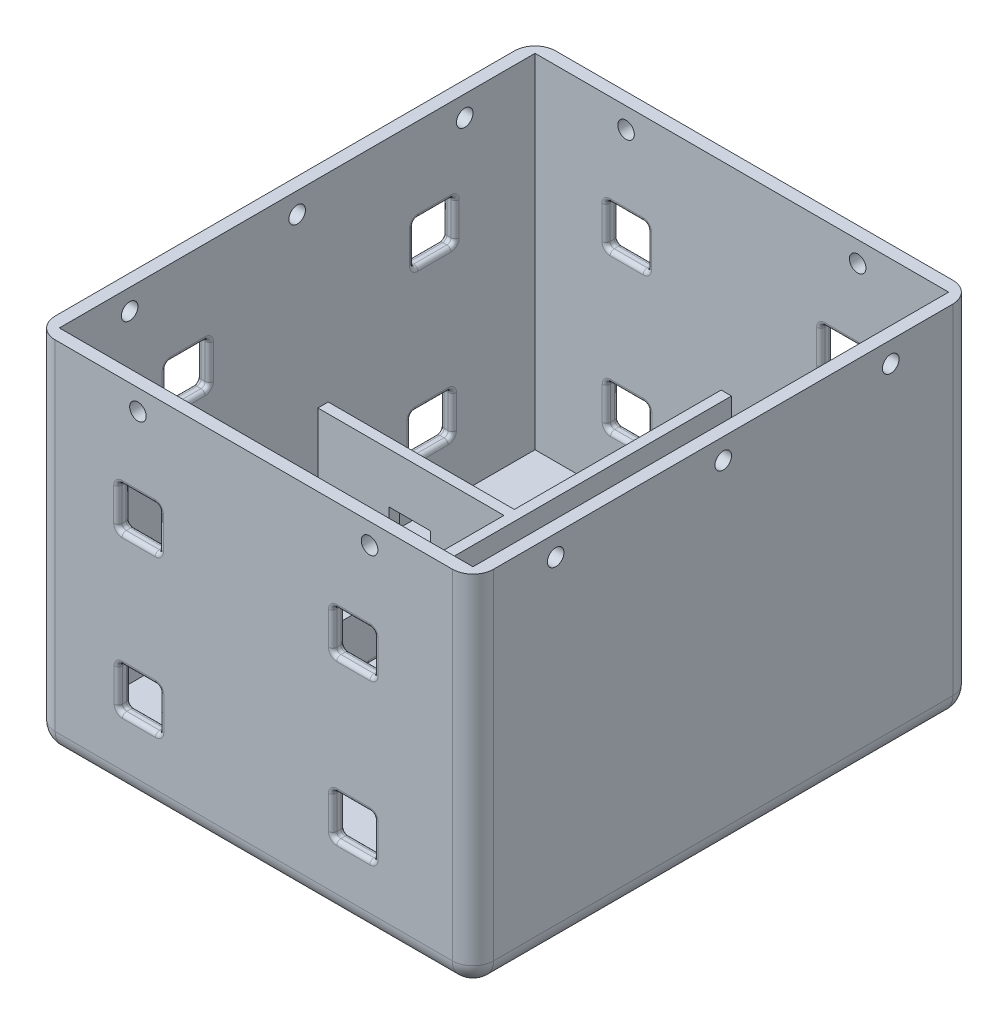
from build123d import *

# Parameters (mm, degrees)
SKETCH1_W                      = 106
SKETCH1_H                      = 121
SKETCH1_W_2                    = 100
SKETCH1_H_2                    = 115
BOSS_EXTRUDE1_DEPTH            = 83
SKETCH2_W                      = 106
SKETCH2_H                      = 121
BOSS_EXTRUDE2_DEPTH            = 4
BOSS_EXTRUDE3_DEPTH            = 35
CUT_EXTRUDE1_DEPTH             = 92
CUT_EXTRUDE1_DEPTH_BACK        = 75
SKETCH6_W                      = 10
SKETCH6_H                      = 10
CUT_EXTRUDE2_REACH             = 119.954
SKETCH7_W                      = 10
SKETCH7_H                      = 10
CUT_EXTRUDE2_DIRECTION_2_DEPTH = 8
SKETCH8_W                      = 10
SKETCH8_H                      = 10
CUT_EXTRUDE3_DEPTH             = 138
SKETCH9_W                      = 10
SKETCH9_H                      = 10
CUT_EXTRUDE4_DEPTH             = 138
SKETCH10_W                     = 10
SKETCH10_H                     = 10
SKETCH10_W_2                   = 10.370040033
SKETCH10_H_2                   = 10.370040033
CUT_EXTRUDE5_DEPTH             = 78
SKETCH11_R                     = 2
CUT_EXTRUDE6_DEPTH             = 132
SKETCH12_R                     = 2
CUT_EXTRUDE7_DEPTH             = 132
FILLET1_R                      = 5
FILLET2_R                      = 5
FILLET4_R                      = 1


with BuildPart() as part:
    # Sketch1 → Boss-Extrude1 (new body)
    with BuildSketch(Plane(origin=(0, 0, 0), x_dir=(1, 0, 0), z_dir=(0, 1, 0))):
        Rectangle(SKETCH1_W, SKETCH1_H)
        Rectangle(SKETCH1_W_2, SKETCH1_H_2, mode=Mode.SUBTRACT)
    extrude(amount=BOSS_EXTRUDE1_DEPTH)

    # Sketch2 → Boss-Extrude2 (add)
    with BuildSketch(Plane.XZ):
        Rectangle(SKETCH2_W, SKETCH2_H)
    extrude(amount=BOSS_EXTRUDE2_DEPTH)

    # Sketch3 → Boss-Extrude3 (add)
    with BuildSketch(Plane(origin=(0, 0, 0), x_dir=(1, 0, 0), z_dir=(0, 1, 0))):
        Polygon((-5, 57.5), (-5, 7.5), (-50, 7.5), (-50, 5), (-5, 5), (-5, -57.5), (-2.5, -57.5), (-2.5, 57.5), align=None)
    extrude(amount=BOSS_EXTRUDE3_DEPTH)

    # Sketch6 → Cut-Extrude1 (cut, two sides: drawn at the far end of the back side and taken through both)
    with BuildSketch(Plane.XY.offset(-5).offset(-CUT_EXTRUDE1_DEPTH_BACK)):
        with Locations((-27.748825873, 17.873316531)):
            Rectangle(SKETCH6_W, SKETCH6_H)
        with Locations((24.072315053, 17.126745646)):
            Rectangle(SKETCH6_W, SKETCH6_H)
    extrude(amount=CUT_EXTRUDE1_DEPTH + CUT_EXTRUDE1_DEPTH_BACK, mode=Mode.SUBTRACT)

    # Cut-Extrude2: up to this face of the body (flat: up to its plane)
    cut_extrude2_end = Plane(part.part.faces().sort_by_distance((-53, 39.5, 0))[0])
    # Sketch7 → Cut-Extrude2 (cut, up to the picked face)
    with BuildSketch(Plane.ZY.offset(5), mode=Mode.PRIVATE) as cut_extrude2_sk1:
        with Locations((26.25, 17.5)):
            Rectangle(SKETCH7_W, SKETCH7_H)
    cut_extrude2_tool1 = split(extrude(cut_extrude2_sk1.sketch, amount=CUT_EXTRUDE2_REACH, mode=Mode.PRIVATE), bisect_by=cut_extrude2_end, keep=Keep.BOTH, mode=Mode.PRIVATE)
    # Sketch7 → Cut-Extrude2 (cut, up to the picked face)
    with BuildSketch(Plane.ZY.offset(5), mode=Mode.PRIVATE) as cut_extrude2_sk2:
        with Locations((-32.5, 17.5)):
            Rectangle(SKETCH7_W, SKETCH7_H)
    cut_extrude2_tool2 = split(extrude(cut_extrude2_sk2.sketch, amount=CUT_EXTRUDE2_REACH, mode=Mode.PRIVATE), bisect_by=cut_extrude2_end, keep=Keep.BOTH, mode=Mode.PRIVATE)
    add(cut_extrude2_tool1.solids().sort_by(Axis((-5, 17.5, 26.25), (-1, 0, 0)))[0], mode=Mode.SUBTRACT)
    add(cut_extrude2_tool2.solids().sort_by(Axis((-5, 17.5, -32.5), (-1, 0, 0)))[0], mode=Mode.SUBTRACT)

    # Sketch7 → Cut-Extrude2 direction 2 (cut)
    with BuildSketch(Plane.ZY.offset(5)):
        with Locations((26.25, 17.5)):
            Rectangle(SKETCH7_W, SKETCH7_H)
        with Locations((-32.5, 17.5)):
            Rectangle(SKETCH7_W, SKETCH7_H)
    extrude(amount=-CUT_EXTRUDE2_DIRECTION_2_DEPTH, mode=Mode.SUBTRACT)

    # Sketch8 → Cut-Extrude3 (cut)
    with BuildSketch(Plane.XY.offset(60.5)):
        with Locations((-27.85, 55.67)):
            Rectangle(SKETCH8_W, SKETCH8_H)
    extrude(amount=-CUT_EXTRUDE3_DEPTH, mode=Mode.SUBTRACT)

    # Sketch9 → Cut-Extrude4 (cut)
    with BuildSketch(Plane.XY.offset(60.5)):
        with Locations((24.072315053, 55.67)):
            Rectangle(SKETCH9_W, SKETCH9_H)
    extrude(amount=-CUT_EXTRUDE4_DEPTH, mode=Mode.SUBTRACT)

    # Sketch10 → Cut-Extrude5 (cut)
    with BuildSketch(Plane.ZY.offset(53)):
        with Locations((-33.18, 57.54)):
            Rectangle(SKETCH10_W, SKETCH10_H)
        with Locations((26.435020017, 57.354979984)):
            Rectangle(SKETCH10_W_2, SKETCH10_H_2)
    extrude(amount=-CUT_EXTRUDE5_DEPTH, mode=Mode.SUBTRACT)

    # Sketch11 → Cut-Extrude6 (cut)
    with BuildSketch(Plane.ZY.offset(53)):
        with Locations((-40.5, 78)):
            Circle(SKETCH11_R)
        with Locations((0, 78)):
            Circle(SKETCH11_R)
        with Locations((40.5, 78)):
            Circle(SKETCH11_R)
    extrude(amount=-CUT_EXTRUDE6_DEPTH, mode=Mode.SUBTRACT)

    # Sketch12 → Cut-Extrude7 (cut)
    with BuildSketch(Plane(origin=(0, 0, -60.5), x_dir=(-1, 0, 0), z_dir=(0, 0, -1))):
        with Locations((-28, 78)):
            Circle(SKETCH12_R)
        with Locations((28, 78)):
            Circle(SKETCH12_R)
    extrude(amount=-CUT_EXTRUDE7_DEPTH, mode=Mode.SUBTRACT)

    # Fillet1
    fillet1_edges = [part.edges().sort_by_distance(p)[0] for p in [
        (53, 39.5, 60.5),
        (-53, 39.5, 60.5),
        (-53, 39.5, -60.5),
        (53, 39.5, -60.5),
    ]]
    fillet(fillet1_edges, radius=FILLET1_R)

    # Fillet2
    fillet2_edges = [part.edges().sort_by_distance(p)[0] for p in [
        (0, -4, -60.5),
        (-53, -4, 0),
        (53, -4, 0),
        (0, -4, 60.5),
        (-51.535533906, -4, -59.035533906),
        (-51.535533906, -4, 59.035533906),
        (51.535533906, -4, 59.035533906),
        (51.535533906, -4, -59.035533906),
    ]]
    fillet(fillet2_edges, radius=FILLET2_R)

    # Fillet4
    fillet4_edges = [part.edges().sort_by_distance(p)[0] for p in [
        (29.072315053, 17.126745646, -57.5),
        (29.072315053, 12.126745646, -59),
        (29.072315053, 12.126745646, 59),
        (29.072315053, 17.126745646, 57.5),
        (29.072315053, 17.126745646, -60.5),
        (24.072315053, 22.126745646, -57.5),
        (29.072315053, 22.126745646, -59),
        (29.072315053, 22.126745646, 59),
        (24.072315053, 22.126745646, 57.5),
        (24.072315053, 22.126745646, -60.5),
        (19.072315053, 17.126745646, -57.5),
        (19.072315053, 22.126745646, -59),
        (19.072315053, 22.126745646, 59),
        (19.072315053, 17.126745646, 57.5),
        (19.072315053, 17.126745646, -60.5),
        (24.072315053, 12.126745646, -57.5),
        (19.072315053, 12.126745646, -59),
        (19.072315053, 12.126745646, 59),
        (24.072315053, 12.126745646, 57.5),
        (24.072315053, 12.126745646, -60.5),
        (-2.5, 22.5, -32.5),
        (-2.5, 17.5, -37.5),
        (-2.5, 12.5, -32.5),
        (-2.5, 17.5, -27.5),
        (-2.5, 22.5, 26.25),
        (-2.5, 17.5, 21.25),
        (-2.5, 12.5, 26.25),
        (-2.5, 17.5, 31.25),
        (-50, 17.5, 31.25),
        (-3.75, 22.5, 31.25),
        (-5, 17.5, 31.25),
        (-51.5, 22.5, 31.25),
        (-53, 17.5, 31.25),
        (-50, 12.5, 26.25),
        (-3.75, 12.5, 31.25),
        (-5, 12.5, 26.25),
        (-51.5, 12.5, 31.25),
        (-53, 12.5, 26.25),
        (-50, 17.5, 21.25),
        (-3.75, 12.5, 21.25),
        (-5, 17.5, 21.25),
        (-51.5, 12.5, 21.25),
        (-53, 17.5, 21.25),
        (-50, 22.5, 26.25),
        (-3.75, 22.5, 21.25),
        (-5, 22.5, 26.25),
        (-51.5, 22.5, 21.25),
        (-53, 22.5, 26.25),
        (-50, 17.5, -27.5),
        (-3.75, 22.5, -27.5),
        (-5, 17.5, -27.5),
        (-51.5, 22.5, -27.5),
        (-53, 17.5, -27.5),
        (-50, 12.5, -32.5),
        (-3.75, 12.5, -27.5),
        (-5, 12.5, -32.5),
        (-51.5, 12.5, -27.5),
        (-53, 12.5, -32.5),
        (-50, 17.5, -37.5),
        (-3.75, 12.5, -37.5),
        (-5, 17.5, -37.5),
        (-51.5, 12.5, -37.5),
        (-53, 17.5, -37.5),
        (-50, 22.5, -32.5),
        (-3.75, 22.5, -37.5),
        (-5, 22.5, -32.5),
        (-51.5, 22.5, -37.5),
        (-53, 22.5, -32.5),
        (-32.85, 55.67, -57.5),
        (-32.85, 55.67, 57.5),
        (-32.85, 55.67, -60.5),
        (-32.85, 50.67, -59),
        (-32.85, 50.67, 59),
        (-27.85, 60.67, -57.5),
        (-27.85, 60.67, 57.5),
        (-27.85, 60.67, -60.5),
        (-32.85, 60.67, -59),
        (-32.85, 60.67, 59),
        (-22.85, 55.67, -57.5),
        (-22.85, 55.67, 57.5),
        (-22.85, 55.67, -60.5),
        (-22.85, 60.67, -59),
        (-22.85, 60.67, 59),
        (-27.85, 50.67, -57.5),
        (-27.85, 50.67, 57.5),
        (-27.85, 50.67, -60.5),
        (-22.85, 50.67, -59),
        (-22.85, 50.67, 59),
        (-32.85, 55.67, 60.5),
        (-27.85, 50.67, 60.5),
        (-22.85, 55.67, 60.5),
        (-27.85, 60.67, 60.5),
        (19.072315053, 55.67, -57.5),
        (19.072315053, 55.67, 57.5),
        (19.072315053, 55.67, -60.5),
        (19.072315053, 50.67, -59),
        (19.072315053, 50.67, 59),
        (24.072315053, 60.67, -57.5),
        (24.072315053, 60.67, 57.5),
        (24.072315053, 60.67, -60.5),
        (19.072315053, 60.67, -59),
        (19.072315053, 60.67, 59),
        (29.072315053, 55.67, -57.5),
        (29.072315053, 55.67, 57.5),
        (29.072315053, 55.67, -60.5),
        (29.072315053, 60.67, -59),
        (29.072315053, 60.67, 59),
        (24.072315053, 50.67, -57.5),
        (24.072315053, 50.67, 57.5),
        (24.072315053, 50.67, -60.5),
        (29.072315053, 50.67, -59),
        (29.072315053, 50.67, 59),
        (19.072315053, 55.67, 60.5),
        (24.072315053, 50.67, 60.5),
        (29.072315053, 55.67, 60.5),
        (24.072315053, 60.67, 60.5),
        (-50, 57.54, -28.18),
        (-50, 52.54, -33.18),
        (-50, 57.54, -38.18),
        (-50, 62.54, -33.18),
        (-51.5, 62.54, -28.18),
        (-51.5, 52.54, -28.18),
        (-51.5, 52.54, -38.18),
        (-51.5, 62.54, -38.18),
        (-53, 57.54, -28.18),
        (-53, 62.54, -33.18),
        (-53, 57.54, -38.18),
        (-53, 52.54, -33.18),
        (-50, 57.354979983, 21.25),
        (-50, 62.54, 26.435020017),
        (-50, 57.354979983, 31.620040033),
        (-50, 52.169959967, 26.435020017),
        (-51.5, 52.169959967, 21.25),
        (-51.5, 62.54, 21.25),
        (-51.5, 62.54, 31.620040033),
        (-51.5, 52.169959967, 31.620040033),
        (-53, 57.354979983, 21.25),
        (-53, 52.169959967, 26.435020017),
        (-53, 57.354979983, 31.620040033),
        (-53, 62.54, 26.435020017),
        (24.072315053, 12.126745646, 60.5),
        (19.072315053, 17.126745646, 60.5),
        (24.072315053, 22.126745646, 60.5),
        (29.072315053, 17.126745646, 60.5),
        (-22.748825873, 17.873316531, -57.5),
        (-22.748825873, 12.873316531, -59),
        (-22.748825873, 12.873316531, 59),
        (-22.748825873, 17.873316531, 57.5),
        (-22.748825873, 17.873316531, -60.5),
        (-27.748825873, 22.873316531, -57.5),
        (-22.748825873, 22.873316531, -59),
        (-22.748825873, 22.873316531, 59),
        (-27.748825873, 22.873316531, 57.5),
        (-27.748825873, 22.873316531, -60.5),
        (-32.748825873, 17.873316531, -57.5),
        (-32.748825873, 22.873316531, -59),
        (-32.748825873, 22.873316531, 59),
        (-32.748825873, 17.873316531, 57.5),
        (-32.748825873, 17.873316531, -60.5),
        (-27.748825873, 12.873316531, -57.5),
        (-32.748825873, 12.873316531, -59),
        (-32.748825873, 12.873316531, 59),
        (-27.748825873, 12.873316531, 57.5),
        (-27.748825873, 12.873316531, -60.5),
        (-22.748825873, 17.873316531, 60.5),
        (-27.748825873, 22.873316531, 60.5),
        (-32.748825873, 17.873316531, 60.5),
        (-27.748825873, 12.873316531, 60.5),
    ]]
    fillet(fillet4_edges, radius=FILLET4_R)


solid = part.part
